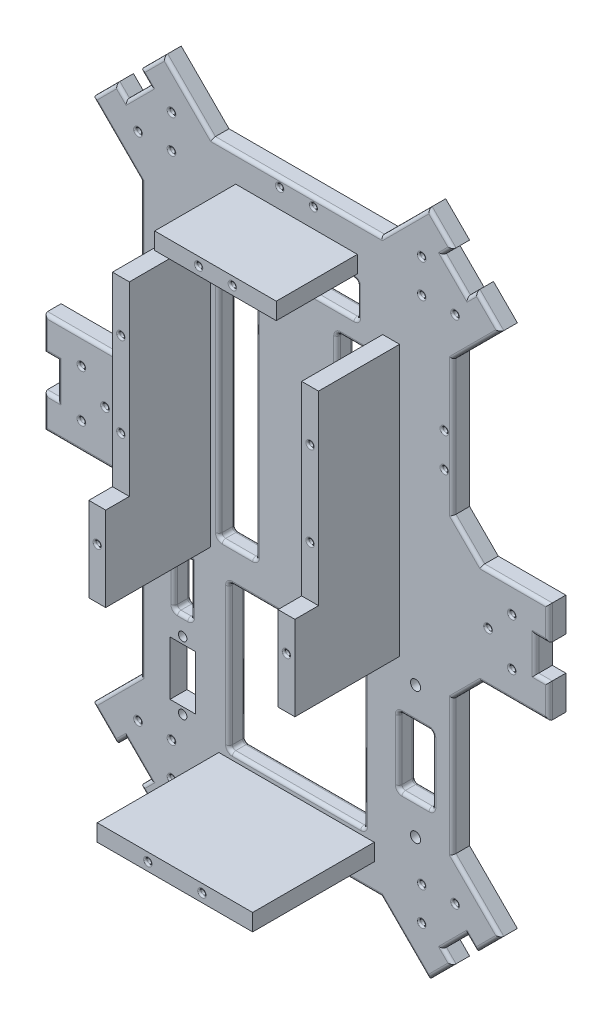
from build123d import *

# Parameters (mm, degrees)
DODANIE_WYCI_GNI_CIE1_DEPTH     = 5
WYTNIJ_WYCI_GNI_CIE7_DEPTH      = 42
WYTNIJ_WYCI_GNI_CIE7_DEPTH_BACK = 60
SZKIC11_R                       = 0.8
WYTNIJ_WYCI_GNI_CIE8_DEPTH      = 36
WYTNIJ_WYCI_GNI_CIE8_DEPTH_BACK = 66
SZKIC12_R                       = 0.75
WYTNIJ_WYCI_GNI_CIE9_DEPTH      = 54
WYTNIJ_WYCI_GNI_CIE9_DEPTH_BACK = 47
SZKIC13_R                       = 1.5
SZKIC13_R_2                     = 1.25
SZKIC13_W                       = 11
SZKIC13_H                       = 70
SZKIC13_W_2                     = 40
SZKIC13_H_2                     = 42.9
SZKIC13_W_3                     = 5
SZKIC13_H_3                     = 15
SZKIC13_W_4                     = 7.5
SZKIC13_H_4                     = 16
SZKIC13_W_5                     = 10
SZKIC13_H_5                     = 20
SZKIC13_W_6                     = 36
SZKIC13_H_6                     = 10
SZKIC14_W                       = 5
SZKIC14_H                       = 80
SZKIC14_R                       = 0.75
SZKIC14_W_2                     = 46
SZKIC14_H_2                     = 5
SZKIC14_W_3                     = 36
DODANIE_WYCI_GNI_CIE7_DEPTH     = 24
SZKIC14_9_W                     = 46
SZKIC14_9_H                     = 5
SZKIC14_9_R                     = 0.75
DODANIE_WYCI_GNI_CIE8_DEPTH     = 36
SZKIC17_W                       = 5
SZKIC17_H                       = 25
SZKIC17_R                       = 0.75
DODANIE_WYCI_GNI_CIE9_DEPTH     = 36
ZAOKR_GLENIE3_R                 = 1
ZAOKR_GLENIE4_R                 = 1
ZAOKR_GLENIE5_R                 = 0.5


with BuildPart() as part:
    # Szkic1 → Dodanie-wyciągnięcie1 (new body)
    with BuildSketch(Plane.XY):
        Polygon((0, 0), (-50, 0), (-64.142135624, 14.142135624), (-71.213203436, 7.071067812), (-68.384776311, 4.242640687), (-75.455844123, -2.828427125), (-78.284271247, 0), (-85.355339059, -7.071067812), (-71.213203436, -21.213203436), (-71.213203436, -61.213203436), (-79.69848481, -69.69848481), (-99.69848481, -69.69848481), (-99.69848481, -79.69848481), (-95.69848481, -79.69848481), (-95.69848481, -89.69848481), (-99.69848481, -89.69848481), (-99.69848481, -99.69848481), (-79.69848481, -99.69848481), (-71.213203436, -108.183766184), (-71.213203436, -148.183766184), (-85.355339059, -162.325901808), (-78.284271247, -169.39696962), (-75.455844123, -166.568542495), (-68.384776311, -173.639610307), (-71.213203436, -176.468037432), (-64.142135624, -183.539105243), (-50, -169.39696962), (0, -169.39696962), (14.142135624, -183.539105243), (21.213203436, -176.468037432), (18.384776311, -173.639610307), (25.455844123, -166.568542495), (28.284271247, -169.39696962), (35.355339059, -162.325901808), (21.213203436, -148.183766184), (21.213203436, -108.183766184), (29.69848481, -99.69848481), (49.69848481, -99.69848481), (49.69848481, -89.69848481), (45.69848481, -89.69848481), (45.69848481, -79.69848481), (49.69848481, -79.69848481), (49.69848481, -69.69848481), (29.69848481, -69.69848481), (21.213203436, -61.213203436), (21.213203436, -21.213203436), (35.355339059, -7.071067812), (28.284271247, 0), (25.455844123, -2.828427125), (18.384776311, 4.242640687), (21.213203436, 7.071067812), (14.142135624, 14.142135624), align=None)
    extrude(amount=DODANIE_WYCI_GNI_CIE1_DEPTH)

    # Szkic11 → Wytnij-wyciągnięcie7 (cut, two sides: drawn at the far end of the back side and taken through both)
    with BuildSketch(Plane.XY.offset(5).offset(-WYTNIJ_WYCI_GNI_CIE7_DEPTH_BACK)):
        with Locations((-81.69848481, -84.69848481)):
            Circle(SZKIC11_R)
        with Locations((-88.69848481, -77.69848481)):
            Circle(SZKIC11_R)
        with Locations((-88.69848481, -91.69848481)):
            Circle(SZKIC11_R)
        with Locations((-62.02081528, -9.192388155)):
            Circle(SZKIC11_R)
        with Locations((-62.02081528, 0.707106781)):
            Circle(SZKIC11_R)
        with Locations((-71.920310217, -9.192388155)):
            Circle(SZKIC11_R)
        with Locations((12.02081528, -9.192388155)):
            Circle(SZKIC11_R)
        with Locations((12.02081528, 0.707106781)):
            Circle(SZKIC11_R)
        with Locations((21.920310217, -9.192388155)):
            Circle(SZKIC11_R)
        with Locations((31.69848481, -84.69848481)):
            Circle(SZKIC11_R)
        with Locations((38.69848481, -77.69848481)):
            Circle(SZKIC11_R)
        with Locations((38.69848481, -91.69848481)):
            Circle(SZKIC11_R)
        with Locations((12.02081528, -160.204581464)):
            Circle(SZKIC11_R)
        with Locations((21.920310217, -160.204581464)):
            Circle(SZKIC11_R)
        with Locations((12.02081528, -170.104076401)):
            Circle(SZKIC11_R)
        with Locations((-62.02081528, -160.204581464)):
            Circle(SZKIC11_R)
        with Locations((-71.920310217, -160.204581464)):
            Circle(SZKIC11_R)
        with Locations((-62.02081528, -170.104076401)):
            Circle(SZKIC11_R)
    extrude(amount=WYTNIJ_WYCI_GNI_CIE7_DEPTH + WYTNIJ_WYCI_GNI_CIE7_DEPTH_BACK, mode=Mode.SUBTRACT)

    # Szkic12 → Wytnij-wyciągnięcie8 (cut, two sides: drawn at the far end of the back side and taken through both)
    with BuildSketch(Plane.XY.offset(5).offset(-WYTNIJ_WYCI_GNI_CIE8_DEPTH_BACK)):
        with Locations((-30, -2.5)):
            Circle(SZKIC12_R)
        with Locations((-20, -2.5)):
            Circle(SZKIC12_R)
        with Locations((-30, -166.89696962)):
            Circle(SZKIC12_R)
        with Locations((-20, -166.89696962)):
            Circle(SZKIC12_R)
        with Locations((-68.713203436, -40.5)):
            Circle(SZKIC12_R)
        with Locations((-68.713203436, -50.5)):
            Circle(SZKIC12_R)
        with Locations((18.713203436, -40.5)):
            Circle(SZKIC12_R)
        with Locations((18.713203436, -50.5)):
            Circle(SZKIC12_R)
    extrude(amount=WYTNIJ_WYCI_GNI_CIE8_DEPTH + WYTNIJ_WYCI_GNI_CIE8_DEPTH_BACK, mode=Mode.SUBTRACT)

    # Szkic13 → Wytnij-wyciągnięcie9 (cut, two sides: drawn at the far end of the back side and taken through both)
    with BuildSketch(Plane.XY.offset(-WYTNIJ_WYCI_GNI_CIE9_DEPTH_BACK)):
        with Locations((10.213203436, -110)):
            Circle(SZKIC13_R)
        with Locations((10.213203436, -149)):
            Circle(SZKIC13_R)
        with Locations((-58.713203436, -131.99696962)):
            Circle(SZKIC13_R_2)
        with Locations((-58.713203436, -151.99696962)):
            Circle(SZKIC13_R_2)
        with Locations((-42.498203436, -66.5)):
            Rectangle(SZKIC13_W, SZKIC13_H)
        with Locations((-7.501796564, -66.5)):
            Rectangle(SZKIC13_W, SZKIC13_H)
        with Locations((-25.003203436, -132.94696962)):
            Rectangle(SZKIC13_W_2, SZKIC13_H_2)
        with Locations((-58.713203436, -118.99696962)):
            Rectangle(SZKIC13_W_3, SZKIC13_H_3)
        with Locations((-58.713203436, -141.99696962)):
            Rectangle(SZKIC13_W_4, SZKIC13_H_4)
        with Locations((10.213203436, -129.5)):
            Rectangle(SZKIC13_W_5, SZKIC13_H_5)
        with Locations((-25.003203436, -20)):
            Rectangle(SZKIC13_W_6, SZKIC13_H_6)
    extrude(amount=WYTNIJ_WYCI_GNI_CIE9_DEPTH + WYTNIJ_WYCI_GNI_CIE9_DEPTH_BACK, mode=Mode.SUBTRACT)

    # Szkic14 → Dodanie-wyciągnięcie7 (add)
    # profile 1 of 4: a face of its own
    with BuildSketch(Plane.XY.offset(5)):
        with Locations((-52.998203436, -65)):
            Rectangle(SZKIC14_W, SZKIC14_H)
        with Locations((-52.998203436, -40)):
            Circle(SZKIC14_R, mode=Mode.SUBTRACT)
        with Locations((-52.998203436, -65)):
            Circle(SZKIC14_R, mode=Mode.SUBTRACT)
        with Locations((-52.998203436, -90)):
            Circle(SZKIC14_R, mode=Mode.SUBTRACT)
    # profile 2 of 4: a face of its own
    with BuildSketch(Plane.XY.offset(5)):
        with Locations((3.001796564, -65)):
            Rectangle(SZKIC14_W, SZKIC14_H)
        with Locations((3.001796564, -40)):
            Circle(SZKIC14_R, mode=Mode.SUBTRACT)
        with Locations((3.001796564, -65)):
            Circle(SZKIC14_R, mode=Mode.SUBTRACT)
        with Locations((3.001796564, -90)):
            Circle(SZKIC14_R, mode=Mode.SUBTRACT)
    # profile 3 of 4: a face of its own
    with BuildSketch(Plane.XY.offset(5)):
        with Locations((-25.003203436, -158.89696962)):
            Rectangle(SZKIC14_W_2, SZKIC14_H_2)
        with Locations((-33.003203436, -158.89696962)):
            Circle(SZKIC14_R, mode=Mode.SUBTRACT)
        with Locations((-17.003203436, -158.89696962)):
            Circle(SZKIC14_R, mode=Mode.SUBTRACT)
    # profile 4 of 4: a face of its own
    with BuildSketch(Plane.XY.offset(5)):
        with Locations((-25.003203436, -10.69696962)):
            Rectangle(SZKIC14_W_3, SZKIC14_H_2)
        with Locations((-30.003203436, -10.69696962)):
            Circle(SZKIC14_R, mode=Mode.SUBTRACT)
        with Locations((-20.003203436, -10.69696962)):
            Circle(SZKIC14_R, mode=Mode.SUBTRACT)
    extrude(amount=DODANIE_WYCI_GNI_CIE7_DEPTH)

    # Szkic14<9> → Dodanie-wyciągnięcie8 (add)
    with BuildSketch(Plane.XY.offset(5)):
        with Locations((-25.003203436, -158.89696962)):
            Rectangle(SZKIC14_9_W, SZKIC14_9_H)
        with Locations((-33.003203436, -158.89696962)):
            Circle(SZKIC14_9_R, mode=Mode.SUBTRACT)
        with Locations((-17.003203436, -158.89696962)):
            Circle(SZKIC14_9_R, mode=Mode.SUBTRACT)
    extrude(amount=DODANIE_WYCI_GNI_CIE8_DEPTH)

    # Szkic17 → Dodanie-wyciągnięcie9 (add)
    # profile 1 of 2: a face of its own
    with BuildSketch(Plane.XY):
        with Locations((-52.998203436, -92.5)):
            Rectangle(SZKIC17_W, SZKIC17_H)
        with Locations((-52.998203436, -90)):
            Circle(SZKIC17_R, mode=Mode.SUBTRACT)
    # profile 2 of 2: a face of its own
    with BuildSketch(Plane.XY):
        with Locations((3.001796564, -92.5)):
            Rectangle(SZKIC17_W, SZKIC17_H)
        with Locations((3.001796564, -90)):
            Circle(SZKIC17_R, mode=Mode.SUBTRACT)
    extrude(amount=DODANIE_WYCI_GNI_CIE9_DEPTH)

    # Zaokrąglenie3
    zaokr_glenie3_edges = [part.edges().sort_by_distance(p)[0] for p in [
        (-97.69848481, -79.69848481, 5),
        (-95.69848481, -84.69848481, 5),
        (-97.69848481, -89.69848481, 5),
        (-99.69848481, -94.69848481, 5),
        (-89.69848481, -99.69848481, 5),
        (-75.455844123, -103.941125497, 5),
        (-71.213203436, -128.183766184, 5),
        (-78.284271247, -155.254833996, 5),
        (-76.870057685, -167.982756057, 5),
        (-69.798989873, -175.053823869, 5),
        (-81.819805153, -165.861435714, 5),
        (-71.920310217, -170.104076401, 5),
        (-67.67766953, -180.003571337, 5),
        (-57.071067812, -176.468037432, 5),
        (-25, -169.39696962, 5),
        (7.071067812, -176.468037432, 5),
        (17.67766953, -180.003571337, 5),
        (19.798989873, -175.053823869, 5),
        (21.920310217, -170.104076401, 5),
        (26.870057685, -167.982756057, 5),
        (31.819805153, -165.861435714, 5),
        (28.284271247, -155.254833996, 5),
        (21.213203436, -128.183766184, 5),
        (25.455844123, -103.941125497, 5),
        (39.69848481, -99.69848481, 5),
        (49.69848481, -94.69848481, 5),
        (47.69848481, -89.69848481, 5),
        (45.69848481, -84.69848481, 5),
        (47.69848481, -79.69848481, 5),
        (49.69848481, -74.69848481, 5),
        (39.69848481, -69.69848481, 5),
        (25.455844123, -65.455844123, 5),
        (21.213203436, -41.213203436, 5),
        (28.284271247, -14.142135624, 5),
        (31.819805153, -3.535533906, 5),
        (26.870057685, -1.414213562, 5),
        (21.920310217, 0.707106781, 5),
        (19.798989873, 5.656854249, 5),
        (17.67766953, 10.606601718, 5),
        (7.071067812, 7.071067812, 5),
        (-25, 0, 5),
        (-69.798989873, 5.656854249, 5),
        (-67.67766953, 10.606601718, 5),
        (-57.071067812, 7.071067812, 5),
        (-71.920310217, 0.707106781, 5),
        (-76.870057685, -1.414213562, 5),
        (-81.819805153, -3.535533906, 5),
        (-78.284271247, -14.142135624, 5),
        (-71.213203436, -41.213203436, 5),
        (-75.455844123, -65.455844123, 5),
        (-89.69848481, -69.69848481, 5),
        (-99.69848481, -74.69848481, 5),
    ]]
    fillet(zaokr_glenie3_edges, radius=ZAOKR_GLENIE3_R)

    # Zaokrąglenie4
    zaokr_glenie4_edges = [part.edges().sort_by_distance(p)[0] for p in [
        (-56.213203436, -118.99696962, 5),
        (-61.213203436, -118.99696962, 5),
        (-61.213203436, -118.99696962, 0),
        (-56.213203436, -118.99696962, 0),
        (-45.003203436, -132.94696962, 5),
        (-5.003203436, -132.94696962, 5),
        (-5.003203436, -132.94696962, 0),
        (-45.003203436, -132.94696962, 0),
        (-13.001796564, -66.5, 5),
        (-2.001796564, -66.5, 5),
        (-2.001796564, -66.5, 0),
        (-13.001796564, -66.5, 0),
        (-47.998203436, -66.5, 5),
        (-36.998203436, -66.5, 5),
        (-36.998203436, -66.5, 0),
        (-47.998203436, -66.5, 0),
        (-7.003203436, -20, 5),
        (-43.003203436, -20, 5),
        (-43.003203436, -20, 0),
        (-7.003203436, -20, 0),
        (-58.713203436, -126.49696962, 5),
        (-61.213203436, -126.49696962, 2.5),
        (-58.713203436, -126.49696962, 0),
        (-56.213203436, -126.49696962, 2.5),
        (-25.003203436, -154.39696962, 5),
        (-45.003203436, -154.39696962, 2.5),
        (-25.003203436, -154.39696962, 0),
        (-5.003203436, -154.39696962, 2.5),
        (-25.003203436, -111.49696962, 5),
        (-5.003203436, -111.49696962, 2.5),
        (-25.003203436, -111.49696962, 0),
        (-45.003203436, -111.49696962, 2.5),
        (-7.501796564, -101.5, 5),
        (-13.001796564, -101.5, 2.5),
        (-7.501796564, -101.5, 0),
        (-2.001796564, -101.5, 2.5),
        (-7.501796564, -31.5, 5),
        (-2.001796564, -31.5, 2.5),
        (-7.501796564, -31.5, 0),
        (-13.001796564, -31.5, 2.5),
        (-42.498203436, -101.5, 5),
        (-47.998203436, -101.5, 2.5),
        (-42.498203436, -101.5, 0),
        (-36.998203436, -101.5, 2.5),
        (-42.498203436, -31.5, 5),
        (-36.998203436, -31.5, 2.5),
        (-42.498203436, -31.5, 0),
        (-47.998203436, -31.5, 2.5),
        (-25.003203436, -15, 5),
        (-7.003203436, -15, 2.5),
        (-25.003203436, -15, 0),
        (-43.003203436, -15, 2.5),
        (-25.003203436, -25, 5),
        (-43.003203436, -25, 2.5),
        (-25.003203436, -25, 0),
        (-7.003203436, -25, 2.5),
        (-58.713203436, -111.49696962, 0),
        (-58.713203436, -111.49696962, 5),
        (10.213203436, -139.5, 5),
        (10.213203436, -119.5, 5),
        (10.213203436, -119.5, 0),
        (10.213203436, -139.5, 0),
        (15.213203436, -129.5, 5),
        (15.213203436, -139.5, 2.5),
        (15.213203436, -129.5, 0),
        (15.213203436, -119.5, 2.5),
        (5.213203436, -129.5, 5),
        (5.213203436, -119.5, 2.5),
        (5.213203436, -129.5, 0),
        (5.213203436, -139.5, 2.5),
    ]]
    fillet(zaokr_glenie4_edges, radius=ZAOKR_GLENIE4_R)

    # Zaokrąglenie5
    zaokr_glenie5_edges = [part.edges().sort_by_distance(p)[0] for p in [
        (11.22081528, -170.104076401, 5),
        (11.22081528, -160.204581464, 5),
        (21.120310217, -160.204581464, 5),
        (-20.75, -166.89696962, 5),
        (-30.75, -166.89696962, 5),
        (-62.82081528, -170.104076401, 5),
        (-62.82081528, -160.204581464, 5),
        (-72.720310217, -160.204581464, 5),
        (-69.463203436, -50.5, 5),
        (-69.463203436, -40.5, 5),
        (37.89848481, -91.69848481, 5),
        (30.89848481, -84.69848481, 5),
        (37.89848481, -77.69848481, 5),
        (17.963203436, -50.5, 5),
        (17.963203436, -40.5, 5),
        (21.120310217, -9.192388155, 5),
        (11.22081528, -9.192388155, 5),
        (-30.75, -2.5, 5),
        (-20.75, -2.5, 5),
        (11.22081528, 0.707106781, 5),
        (-62.82081528, -9.192388155, 5),
        (-72.720310217, -9.192388155, 5),
        (-62.82081528, 0.707106781, 5),
        (-89.49848481, -91.69848481, 5),
        (-82.49848481, -84.69848481, 5),
        (-89.49848481, -77.69848481, 5),
        (-20.753203436, -10.69696962, 29),
        (-30.753203436, -10.69696962, 29),
        (-33.753203436, -158.89696962, 41),
        (-17.753203436, -158.89696962, 41),
        (2.251796564, -90, 36),
        (2.251796564, -65, 29),
        (2.251796564, -40, 29),
        (-53.748203436, -90, 36),
        (-53.748203436, -65, 29),
        (-53.748203436, -40, 29),
    ]]
    fillet(zaokr_glenie5_edges, radius=ZAOKR_GLENIE5_R)


solid = part.part
